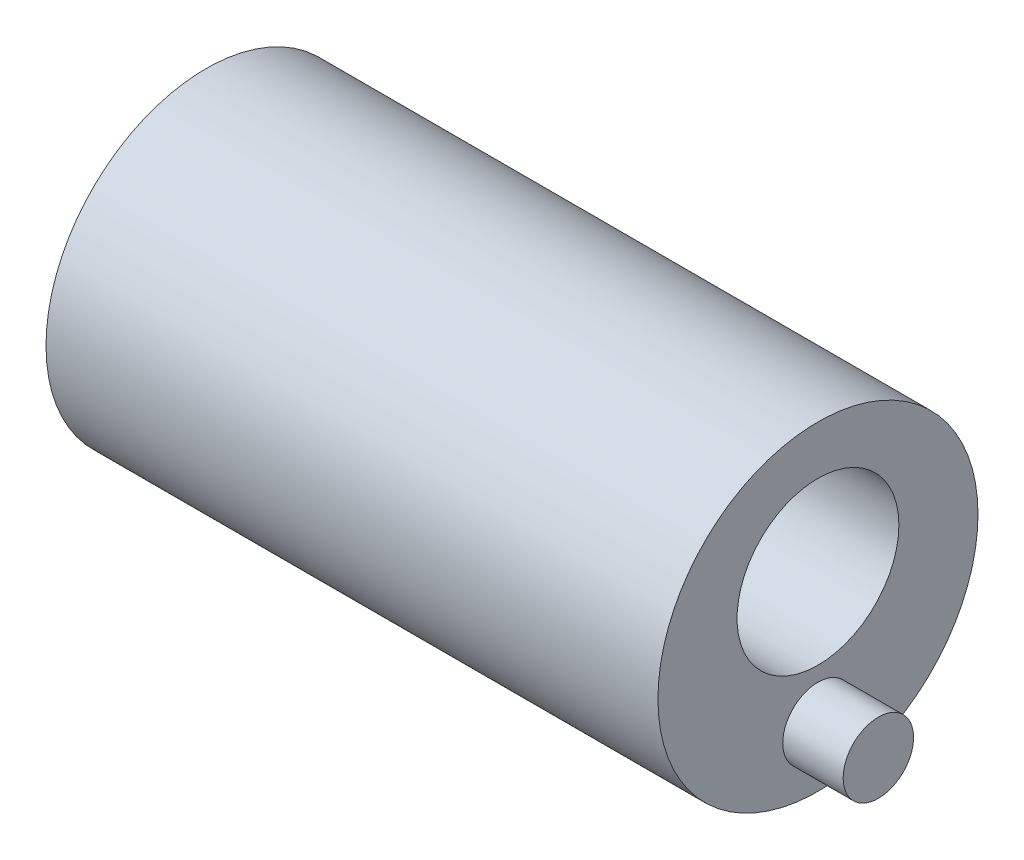
from build123d import *

# Parameters (mm, degrees)
SKETCH1_R           = 100.965
BOSS_EXTRUDE1_DEPTH = 386.08
SKETCH2_R           = 51.054
CUT_EXTRUDE1_DEPTH  = 412.637739827
SKETCH3_R           = 22.225
BOSS_EXTRUDE2_DEPTH = 38.1


with BuildPart() as part:
    # Sketch1 → Boss-Extrude1 (new body)
    with BuildSketch(Plane(origin=(0, 0, 0), x_dir=(0, 0, -1), z_dir=(1, 0, 0))):
        Circle(SKETCH1_R)
    extrude(amount=-BOSS_EXTRUDE1_DEPTH)

    # Sketch2 → Cut-Extrude1 (cut, through all)
    with BuildSketch(Plane(origin=(0, 0, 0), x_dir=(0, 0, -1), z_dir=(1, 0, 0))):
        with Locations((0, 19.05)):
            Circle(SKETCH2_R)
    extrude(amount=-CUT_EXTRUDE1_DEPTH, mode=Mode.SUBTRACT)

    # Sketch3 → Boss-Extrude2 (add)
    with BuildSketch(Plane(origin=(0, 0, 0), x_dir=(0, 0, -1), z_dir=(1, 0, 0))):
        with Locations(Location((0, -63.5, 0), (0, 0, 180))):
            Circle(SKETCH3_R)
    extrude(amount=BOSS_EXTRUDE2_DEPTH)


solid = part.part
